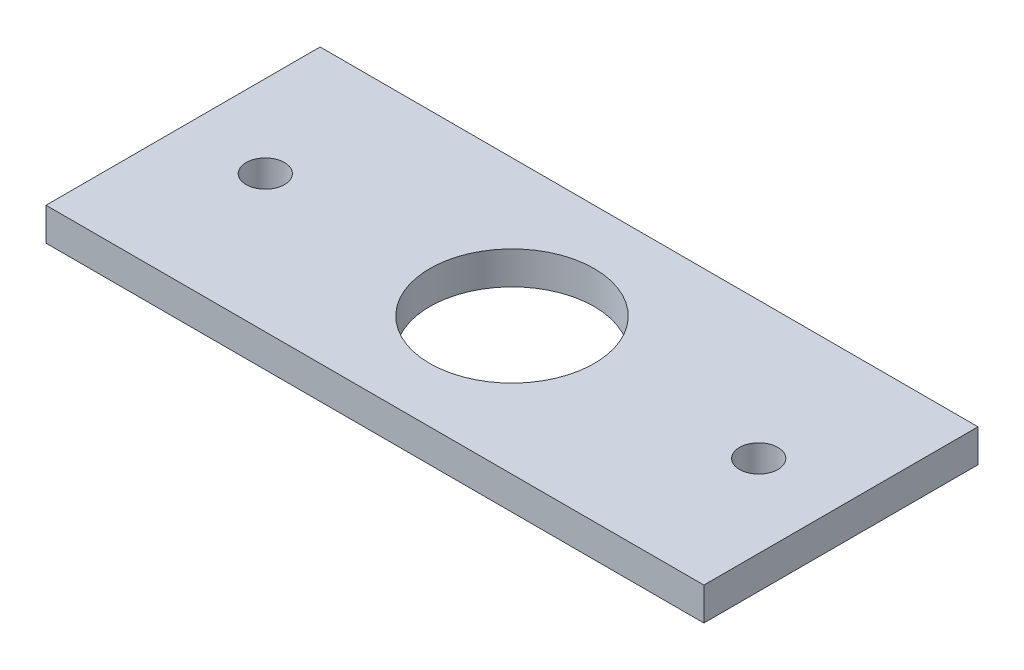
from build123d import *

# Parameters (mm, degrees)
SKETCH1_W           = 60
SKETCH1_H           = 25
SKETCH1_R           = 7.5
SKETCH1_R_2         = 1.75
BOSS_EXTRUDE1_DEPTH = 3


with BuildPart() as part:
    # Sketch1 → Boss-Extrude1 (new body)
    with BuildSketch(Plane(origin=(0, 0, 0), x_dir=(1, 0, 0), z_dir=(0, 1, 0))):
        Rectangle(SKETCH1_W, SKETCH1_H)
        with Locations(Location((0, 0, 0), (0, 0, 270))):
            Circle(SKETCH1_R, mode=Mode.SUBTRACT)
        with Locations(Location((-22.5, 0, 0), (0, 0, 270))):
            Circle(SKETCH1_R_2, mode=Mode.SUBTRACT)
        with Locations(Location((22.5, 0, 0), (0, 0, 90))):
            Circle(SKETCH1_R_2, mode=Mode.SUBTRACT)
    extrude(amount=BOSS_EXTRUDE1_DEPTH)


solid = part.part
